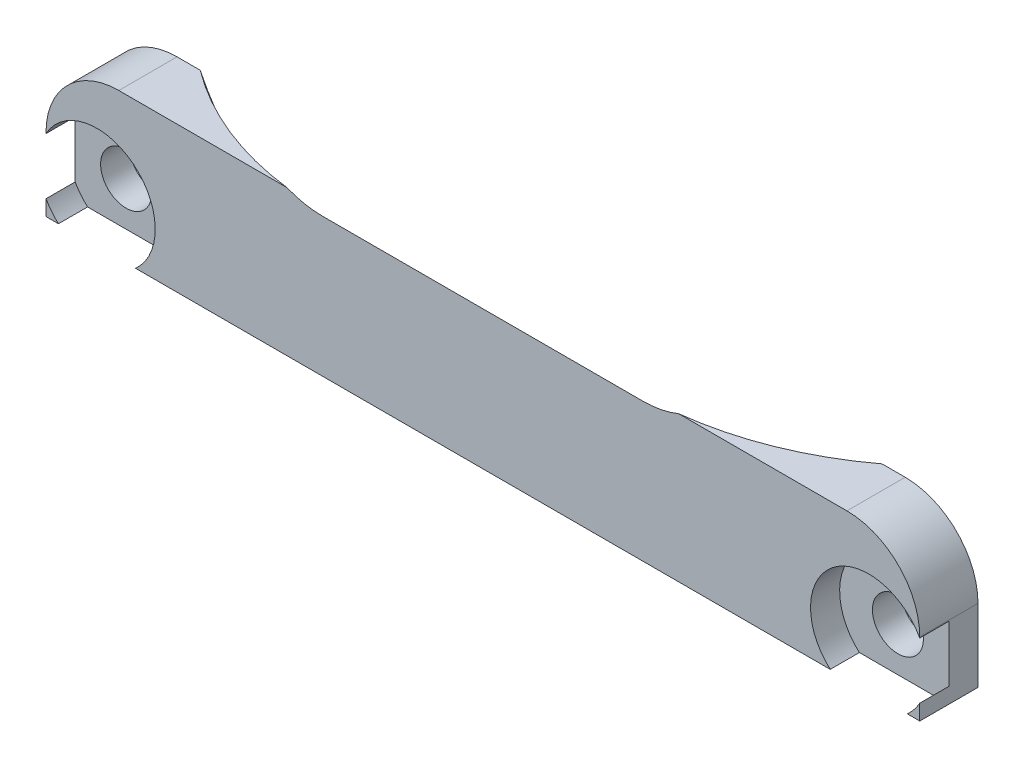
from build123d import *

# Parameters (mm, degrees)
SKETCH1_W           = 60
SKETCH1_H           = 10
BOSS_EXTRUDE1_DEPTH = 20.5
SKETCH3_W           = 60
SKETCH3_H           = 37
CUT_EXTRUDE1_DEPTH  = 38.686204372
FILLET1_R           = 5
SKETCH4_R           = 1.75
CUT_EXTRUDE2_DEPTH  = 31.6757233
SKETCH5_R           = 4
CUT_EXTRUDE5_DEPTH  = 2


with BuildPart() as part:
    # Sketch1 → Boss-Extrude1 (new, symmetric)
    with BuildSketch(Plane.XY):
        Rectangle(SKETCH1_W, SKETCH1_H)
    extrude(amount=BOSS_EXTRUDE1_DEPTH, both=True)

    # Sketch2 → Cut-Revolve1 (revolve, cut)
    with BuildSketch(Plane.XY):
        with BuildLine():
            Line((-32.5, 11), (32.5, 11))
            ThreePointArc((32.5, 11), (26.202795796, -4.202795796), (11, -10.5))
            Line((11, -10.5), (-11, -10.5))
            ThreePointArc((-11, -10.5), (-26.202795796, -4.202795796), (-32.5, 11))
        make_face()
    revolve(axis=Axis((-32.5, 11, 0), (1, 0, 0)), mode=Mode.SUBTRACT)

    # Sketch3 → Cut-Extrude1 (cut, through all)
    with BuildSketch(Plane(origin=(0, 5, 0), x_dir=(1, 0, 0), z_dir=(0, 1, 0))):
        with Locations((0, 2)):
            Rectangle(SKETCH3_W, SKETCH3_H)
    extrude(amount=-CUT_EXTRUDE1_DEPTH, mode=Mode.SUBTRACT)

    # Fillet1
    fillet1_edges = [part.edges().sort_by_distance(p)[0] for p in [
        (-30, 5, 18.5),
        (30, 5, 18.5),
    ]]
    fillet(fillet1_edges, radius=FILLET1_R)

    # Sketch4 → Cut-Extrude2 (cut, through all)
    with BuildSketch(Plane.XY.offset(20.5)):
        with Locations((-26.5, -2)):
            Circle(SKETCH4_R)
        with Locations((26.5, -2)):
            Circle(SKETCH4_R)
    extrude(amount=-CUT_EXTRUDE2_DEPTH, mode=Mode.SUBTRACT)

    # Sketch5 → Cut-Extrude5 (cut)
    with BuildSketch(Plane.XY.offset(20.5)):
        with Locations((-26.5, -2)):
            Circle(SKETCH5_R)
        with Locations((26.5, -2)):
            Circle(SKETCH5_R)
    extrude(amount=-CUT_EXTRUDE5_DEPTH, mode=Mode.SUBTRACT)


solid = part.part
